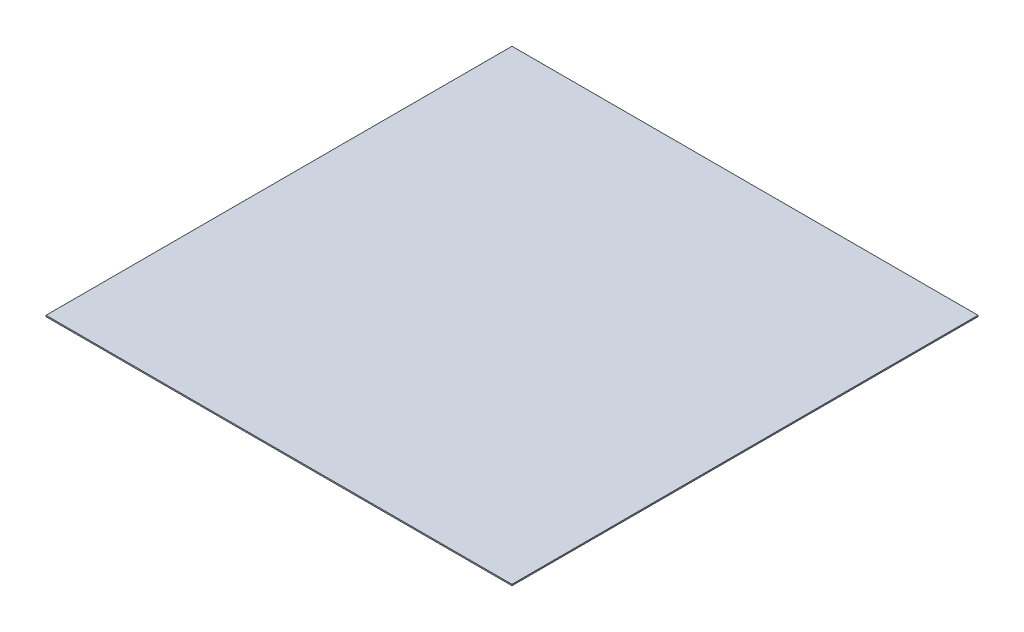
from build123d import *

# Parameters (mm, degrees)
SKETCH1_W           = 3657.6
SKETCH1_H           = 3657.6
BOSS_EXTRUDE1_DEPTH = 10


with BuildPart() as part:
    # Sketch1 → Boss-Extrude1 (new body)
    with BuildSketch(Plane(origin=(0, 0, 0), x_dir=(1, 0, 0), z_dir=(0, 1, 0))):
        Rectangle(SKETCH1_W, SKETCH1_H)
    extrude(amount=BOSS_EXTRUDE1_DEPTH)


solid = part.part
